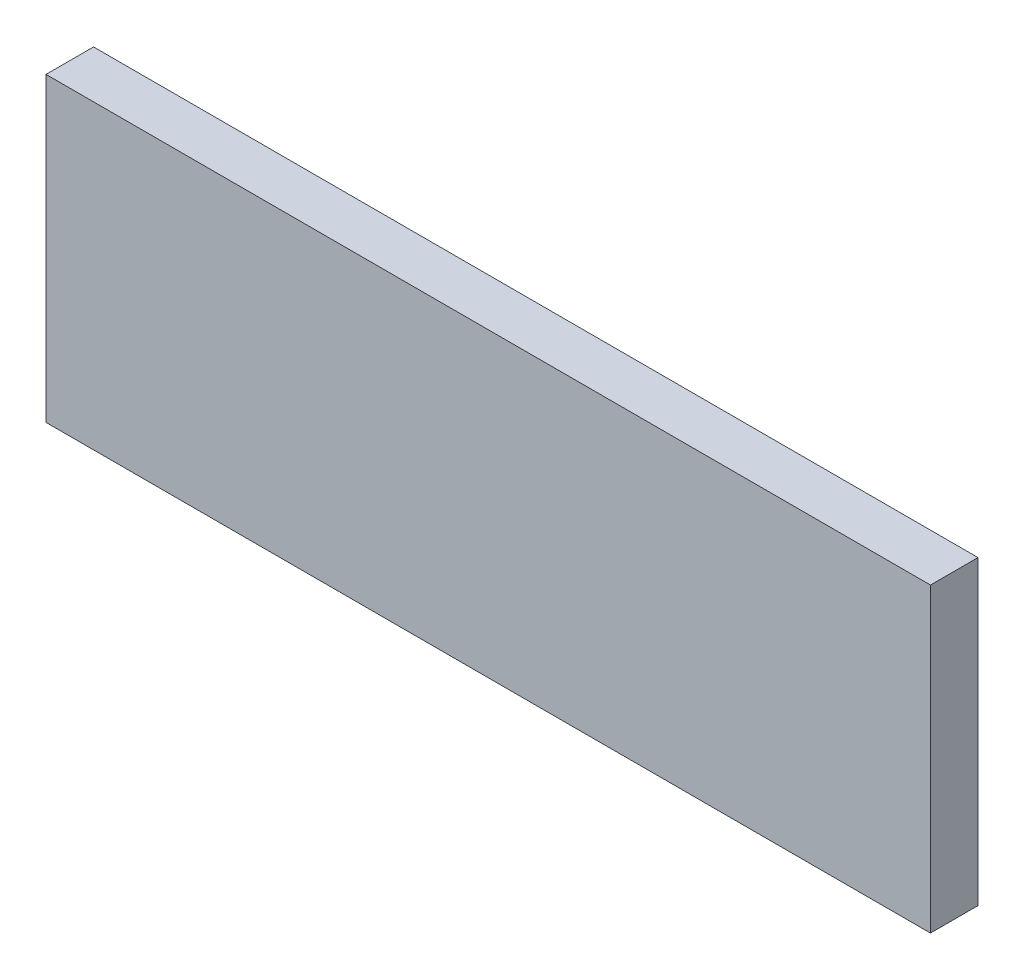
from build123d import *

# Parameters (mm, degrees)
ESBO_O56_W                = 5
ESBO_O56_H                = 31.69504285
RESSALTO_EXTRUS_O13_DEPTH = 93


with BuildPart() as part:
    # Esboço56 → Ressalto-extrusão13 (new body)
    with BuildSketch(Plane.ZY.offset(-55.189074272)):
        with Locations((36.82, -19.516975616)):
            Rectangle(ESBO_O56_W, ESBO_O56_H)
    extrude(amount=RESSALTO_EXTRUS_O13_DEPTH)


solid = part.part
